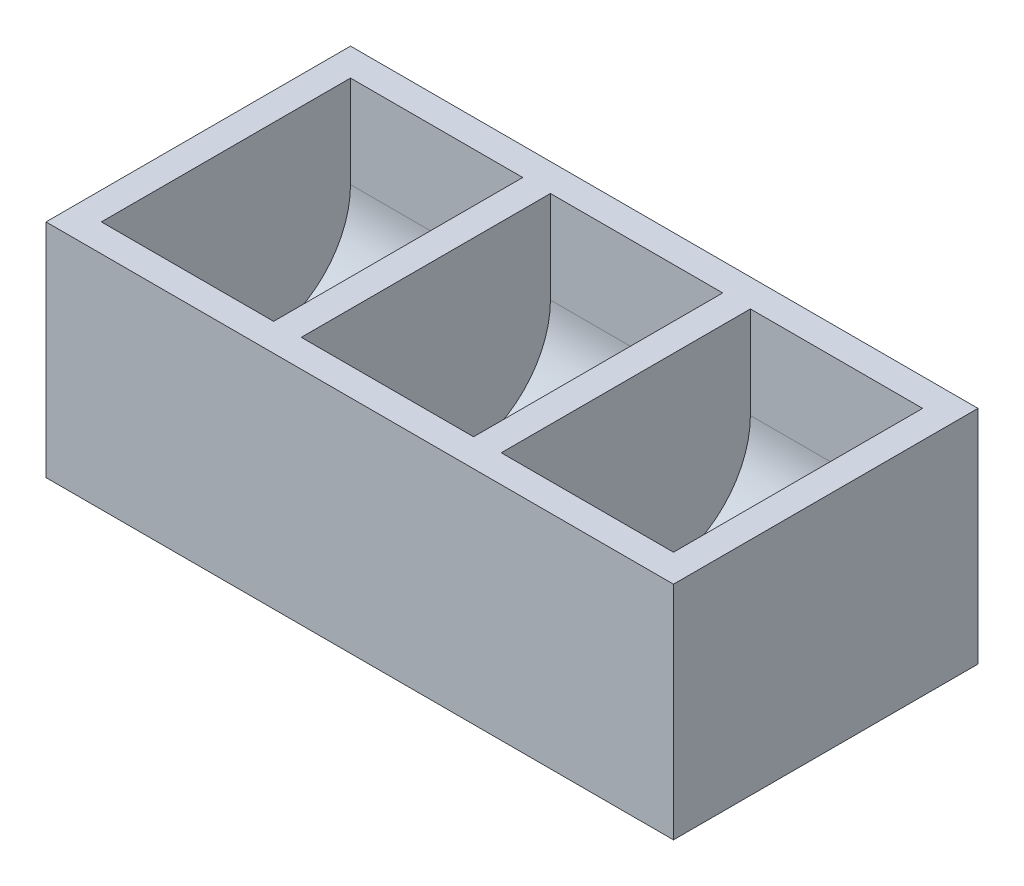
from build123d import *

# Parameters (mm, degrees)
SKETCH1_W           = 136
SKETCH1_H           = 66
BOSS_EXTRUDE1_DEPTH = 48
CUT_EXTRUDE1_START  = 8
SKETCH2_W           = 37.33
SKETCH2_H           = 54
SKETCH2_W_2         = 37.34
CUT_EXTRUDE1_DEPTH  = 48
FILLET1_R           = 20


with BuildPart() as part:
    # Sketch1 → Boss-Extrude1 (new body)
    with BuildSketch(Plane(origin=(0, 0, 0), x_dir=(1, 0, 0), z_dir=(0, 1, 0))):
        Rectangle(SKETCH1_W, SKETCH1_H)
    extrude(amount=BOSS_EXTRUDE1_DEPTH)

    # Sketch2 → Cut-Extrude1 (cut)
    with BuildSketch(Plane(origin=(0, 48, 0), x_dir=(1, 0, 0), z_dir=(0, 1, 0)).offset(CUT_EXTRUDE1_START)):
        with Locations((-43.335, 0)):
            Rectangle(SKETCH2_W, SKETCH2_H)
        Rectangle(SKETCH2_W_2, SKETCH2_H)
        with Locations((43.335, 0)):
            Rectangle(SKETCH2_W, SKETCH2_H)
    extrude(amount=-CUT_EXTRUDE1_DEPTH, mode=Mode.SUBTRACT)

    # Fillet1
    fillet1_edges = [part.edges().sort_by_distance(p)[0] for p in [
        (-43.335, 8, -27),
        (-43.335, 8, 27),
        (0, 8, -27),
        (0, 8, 27),
        (43.335, 8, -27),
        (43.335, 8, 27),
    ]]
    fillet(fillet1_edges, radius=FILLET1_R)


solid = part.part
